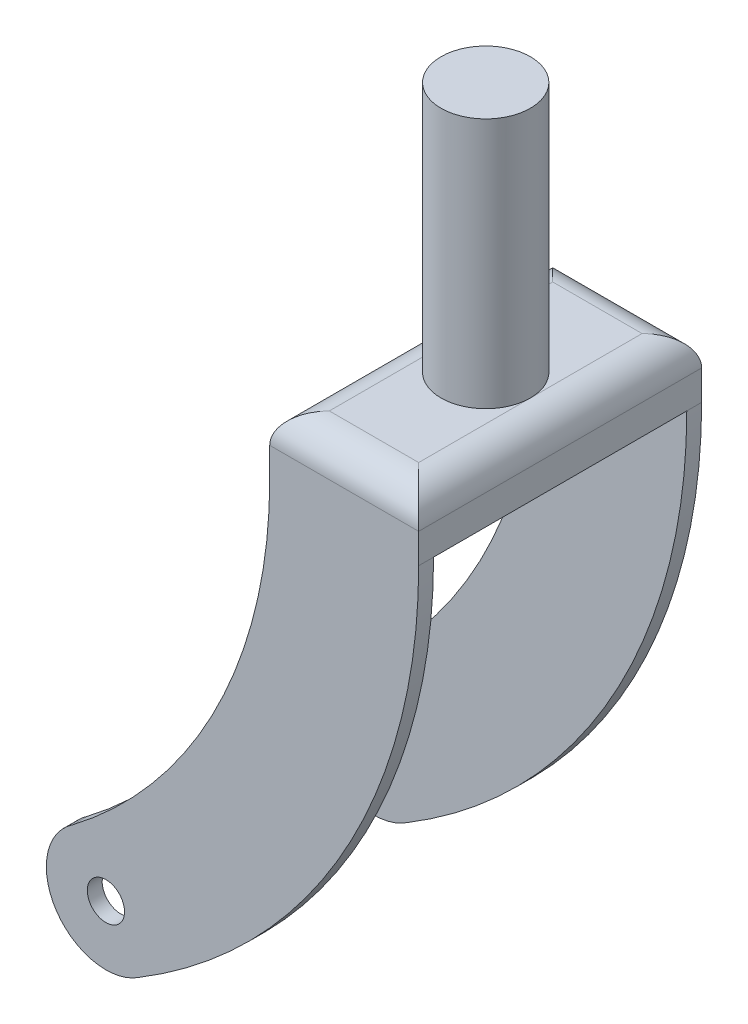
from build123d import *

# Parameters (mm, degrees)
SALIENTE_EXTRUIR1_DEPTH      = 30.1625
SALIENTE_EXTRUIR1_DEPTH_BACK = 30.1625
CROQUIS1_R                   = 3.969
CROQUIS2_W                   = 53.975
CROQUIS2_H                   = 127
CORTAR_EXTRUIR1_DEPTH        = 138.343982508
CROQUIS3_R                   = 9.525
SALIENTE_EXTRUIR2_DEPTH      = 53.5
REDONDEO1_R                  = 6.35


with BuildPart() as part:
    # Croquis1 → Saliente-Extruir1 (new, two sides: drawn at the far end of the back side and taken through both)
    with BuildSketch(Plane.XY.offset(-SALIENTE_EXTRUIR1_DEPTH_BACK)):
        with BuildLine():
            Line((34.925, 95.25), (34.925, 107.95))
            Line((34.925, 107.95), (66.675, 107.95))
            Line((66.675, 107.95), (66.675, 95.25))
            ThreePointArc((66.675, 95.25), (50.749935163, 34.535310409), (7.075086505, -10.546712803))
            ThreePointArc((7.075086505, -10.546712803), (-10.546712803, -7.075086505), (-7.075086505, 10.546712803))
            ThreePointArc((-7.075086505, 10.546712803), (23.848499799, 47.977772084), (34.925, 95.25))
        make_face()
        Circle(CROQUIS1_R, mode=Mode.SUBTRACT)
    extrude(amount=SALIENTE_EXTRUIR1_DEPTH + SALIENTE_EXTRUIR1_DEPTH_BACK)

    # Croquis2 → Cortar-Extruir1 (cut, through all)
    with BuildSketch(Plane(origin=(66.675, 0, 0), x_dir=(0, 0, -1), z_dir=(1, 0, 0))):
        with Locations((0, 31.75)):
            Rectangle(CROQUIS2_W, CROQUIS2_H)
    extrude(amount=-CORTAR_EXTRUIR1_DEPTH, mode=Mode.SUBTRACT)

    # Croquis3 → Saliente-Extruir2 (add)
    with BuildSketch(Plane(origin=(0, 107.95, 0), x_dir=(1, 0, 0), z_dir=(0, 1, 0))):
        with Locations(Location((50.8, 0, 0), (0, 0, 270))):
            Circle(CROQUIS3_R)
    extrude(amount=SALIENTE_EXTRUIR2_DEPTH)

    # Redondeo1
    redondeo1_edges = [part.edges().sort_by_distance(p)[0] for p in [
        (34.925, 107.95, 0),
        (66.675, 107.95, 0),
        (50.8, 107.95, 30.1625),
        (50.8, 107.95, -30.1625),
    ]]
    fillet(redondeo1_edges, radius=REDONDEO1_R)


solid = part.part
